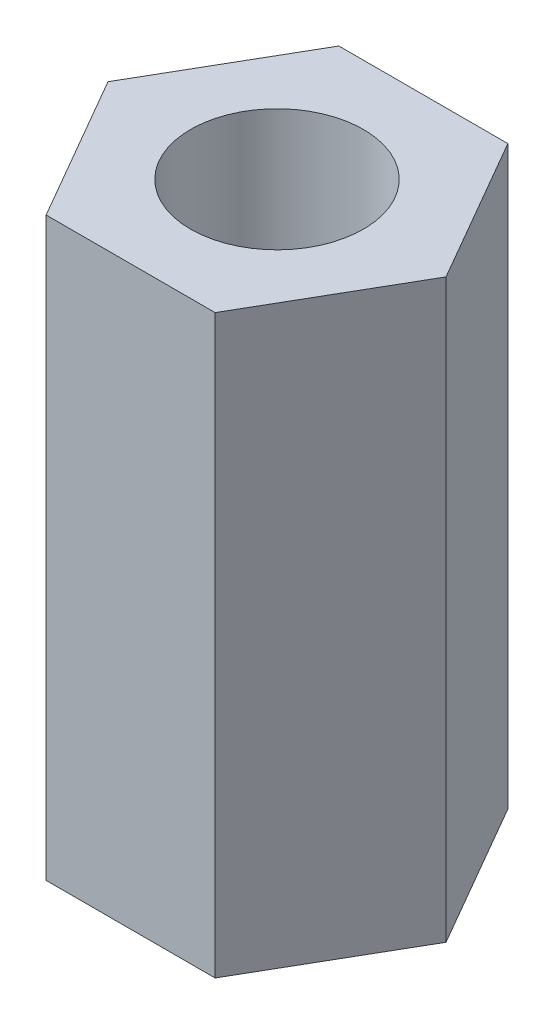
from build123d import *

# Parameters (mm, degrees)
SKETCH1_R           = 1.5
BOSS_EXTRUDE1_DEPTH = 10


with BuildPart() as part:
    # Sketch1 → Boss-Extrude1 (new body)
    with BuildSketch(Plane(origin=(0, 0, 0), x_dir=(1, 0, 0), z_dir=(0, 1, 0))):
        Polygon((1.466469684, 2.54), (-1.466469684, 2.54), (-2.932939367, 0), (-1.466469684, -2.54), (1.466469684, -2.54), (2.932939367, 0), align=None)
        with Locations(Location((0, 0, 0), (0, 0, 270))):
            Circle(SKETCH1_R, mode=Mode.SUBTRACT)
    extrude(amount=BOSS_EXTRUDE1_DEPTH)


solid = part.part
